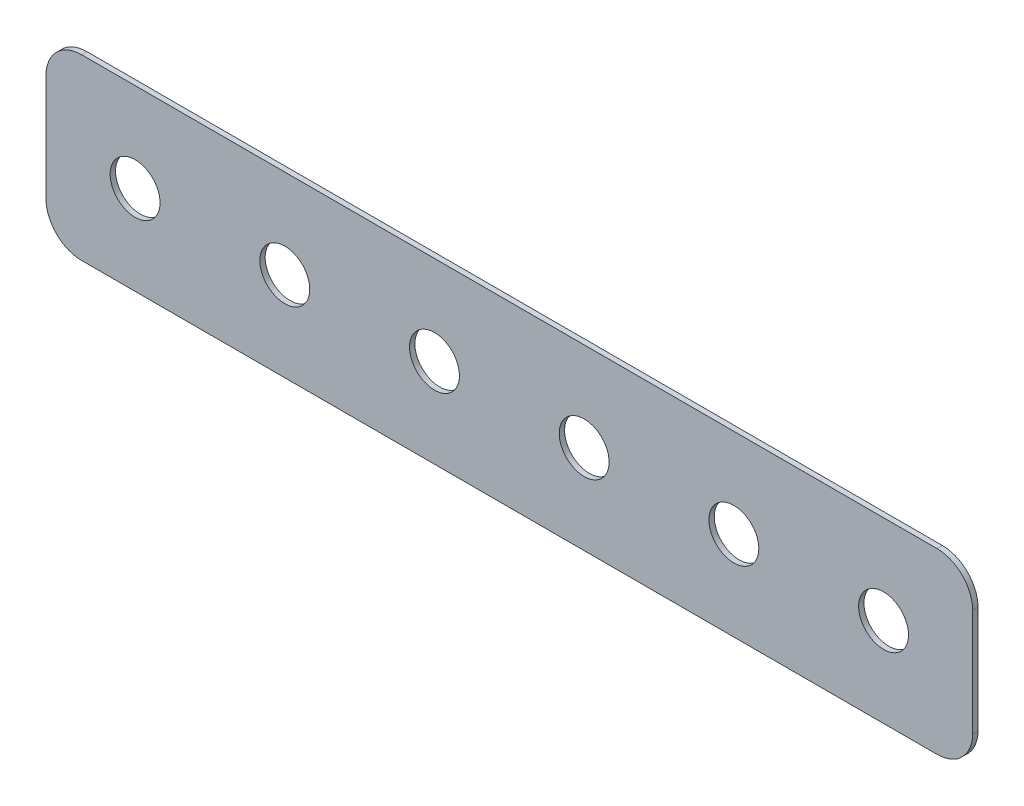
from build123d import *

# Parameters (mm, degrees)
SKETCH1_W           = 3302
SKETCH1_H           = 635
BOSS_EXTRUDE1_DEPTH = 19.05
SKETCH2_R           = 88.9
CUT_EXTRUDE1_DEPTH  = 1682.359614271
FILLET1_R           = 127


with BuildPart() as part:
    # Sketch1 → Boss-Extrude1 (new body)
    with BuildSketch(Plane.XY):
        Rectangle(SKETCH1_W, SKETCH1_H)
    extrude(amount=BOSS_EXTRUDE1_DEPTH)

    # Sketch2 → Cut-Extrude1 (cut, through all)
    with BuildSketch(Plane.XY.offset(19.05)):
        with Locations((-1333.5, 0)):
            Circle(SKETCH2_R)
        with Locations((-800.1, 0)):
            Circle(SKETCH2_R)
        with Locations((-266.7, 0)):
            Circle(SKETCH2_R)
        with Locations((266.7, 0)):
            Circle(SKETCH2_R)
        with Locations((800.1, 0)):
            Circle(SKETCH2_R)
        with Locations((1333.5, 0)):
            Circle(SKETCH2_R)
    extrude(amount=-CUT_EXTRUDE1_DEPTH, mode=Mode.SUBTRACT)

    # Fillet1
    fillet1_edges = [part.edges().sort_by_distance(p)[0] for p in [
        (1651, -317.5, 9.525),
        (-1651, -317.5, 9.525),
        (-1651, 317.5, 9.525),
        (1651, 317.5, 9.525),
    ]]
    fillet(fillet1_edges, radius=FILLET1_R)


solid = part.part
